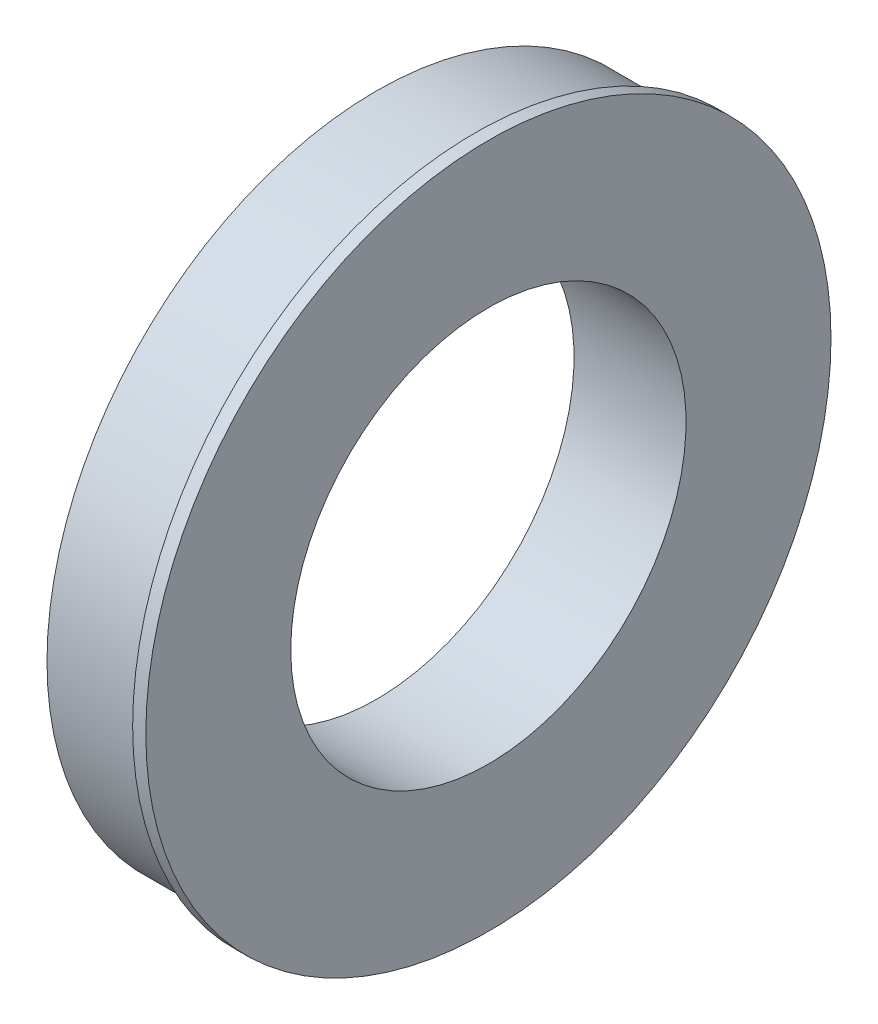
from build123d import *

# Parameters (mm, degrees)
SKETCH1_R           = 63.5
SKETCH1_R_2         = 38.1
BOSS_EXTRUDE1_DEPTH = 19.05
SKETCH3_R           = 66.04
SKETCH3_R_2         = 38.1
BOSS_EXTRUDE2_DEPTH = 2.54


with BuildPart() as part:
    # Sketch1 → Boss-Extrude1 (new body)
    with BuildSketch(Plane(origin=(0, 0, 0), x_dir=(0, 0, -1), z_dir=(1, 0, 0))):
        with Locations(Location((0, 0, 0), (0, 0, 180))):
            Circle(SKETCH1_R)
        with Locations(Location((0, 0, 0), (0, 0, 180))):
            Circle(SKETCH1_R_2, mode=Mode.SUBTRACT)
    extrude(amount=BOSS_EXTRUDE1_DEPTH)

    # Sketch3 → Boss-Extrude2 (add)
    with BuildSketch(Plane(origin=(19.05, 0, 0), x_dir=(0, 0, -1), z_dir=(1, 0, 0))):
        Circle(SKETCH3_R)
        with Locations(Location((0, 0, 0), (0, 0, 180))):
            Circle(SKETCH3_R_2, mode=Mode.SUBTRACT)
    extrude(amount=BOSS_EXTRUDE2_DEPTH)


solid = part.part
